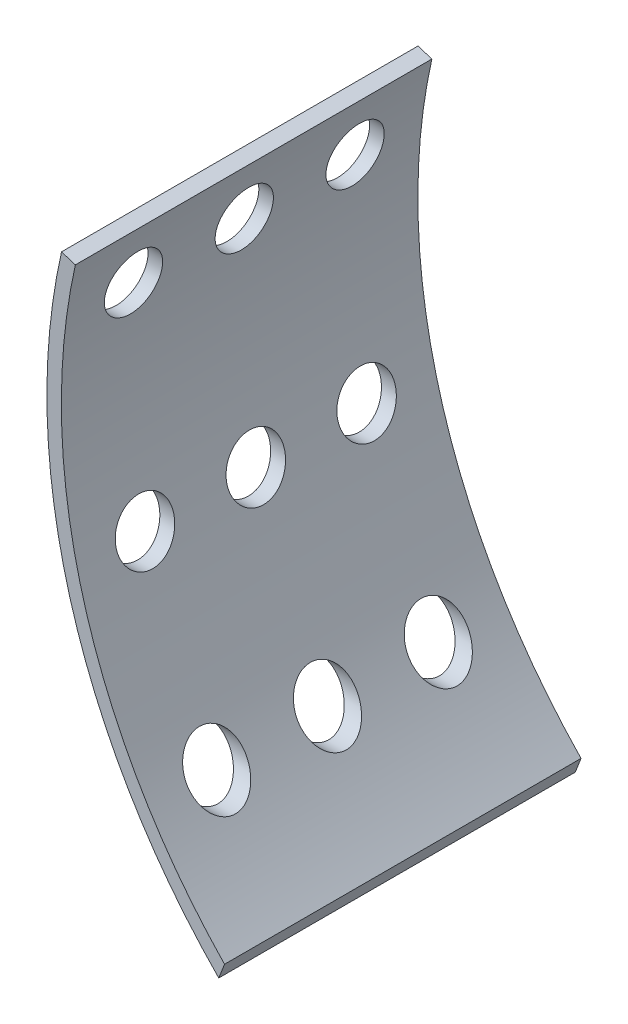
from build123d import *

# Parameters (mm, degrees)
Y_KSEKLIK_EKSTR_ZYON1_DEPTH = 370
SKETCH1_R                   = 30
CUT_EXTRUDE3_DEPTH          = 3481.822078533


with BuildPart() as part:
    # Model → Yükseklik-Ekstrüzyon1 (new body)
    with BuildSketch(Plane.XY):
        with BuildLine():
            Line((2607.289962224, 2081.125921535), (2592.933230394, 2085.655003204))
            ThreePointArc((2592.933230394, 2085.655003204), (2601.606281591, 1779.263260456), (2756.139118134, 1514.554506783))
            Line((2756.139118134, 1514.554506783), (2762.112515814, 1529.91304418))
            ThreePointArc((2762.112515814, 1529.91304418), (2615.281961656, 1786.021263147), (2607.289962224, 2081.125921535))
        make_face()
    extrude(amount=Y_KSEKLIK_EKSTR_ZYON1_DEPTH)

    # Sketch1 → Cut-Extrude3 (cut, through all)
    with BuildSketch(Plane(origin=(0, 0, 0), x_dir=(0, 0, -1), z_dir=(1, 0, 0))):
        with Locations(Location((-185, 2025.655003204, 0), (0, 0, 180))):
            Circle(SKETCH1_R)
        with Locations(Location((-300, 2025.655003204, 0), (0, 0, 180))):
            Circle(SKETCH1_R)
        with Locations(Location((-70, 2025.655003204, 0), (0, 0, 180))):
            Circle(SKETCH1_R)
        with Locations(Location((-300, 1808.152676247, 0), (0, 0, 180))):
            Circle(SKETCH1_R)
        with Locations(Location((-185, 1808.152676247, 0), (0, 0, 180))):
            Circle(SKETCH1_R)
        with Locations(Location((-70, 1808.152676247, 0), (0, 0, 180))):
            Circle(SKETCH1_R)
        with Locations(Location((-300, 1630.762196714, 0), (0, 0, 180))):
            Circle(SKETCH1_R)
        with Locations(Location((-185, 1630.762196714, 0), (0, 0, 180))):
            Circle(SKETCH1_R)
        with Locations(Location((-70, 1630.762196714, 0), (0, 0, 180))):
            Circle(SKETCH1_R)
    extrude(amount=CUT_EXTRUDE3_DEPTH, mode=Mode.SUBTRACT)


solid = part.part
